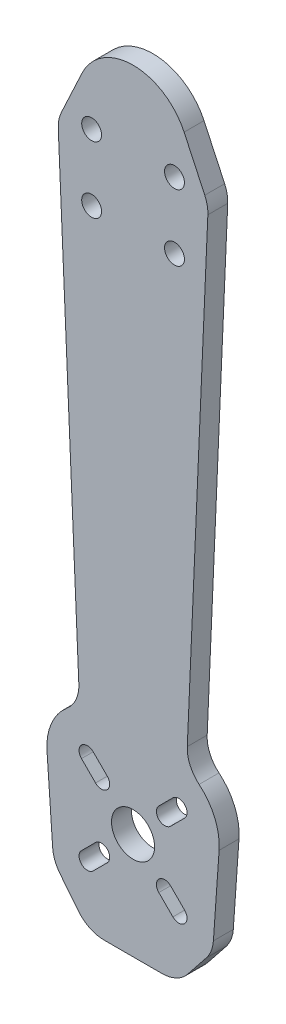
from build123d import *

# Parameters (mm, degrees)
CROQUIS1_R              = 3.25
CROQUIS1_R_2            = 1.5
SALIENTE_EXTRUIR1_DEPTH = 3


with BuildPart() as part:
    # Croquis1 → Saliente-Extruir1 (new body)
    with BuildSketch(Plane(origin=(0, 0, 0), x_dir=(-1, 0, 0), z_dir=(0, 0, -1))):
        with BuildLine():
            Line((8.181538342, 15.560412846), (11.282357346, 86.580844321))
            ThreePointArc((11.282357346, 86.580844321), (11.19104264, 87.774392868), (10.818655174, 88.912032567))
            Line((10.818655174, 88.912032567), (7.70361619, 95.592255225))
            ThreePointArc((7.70361619, 95.592255225), (0, 100.5), (-7.70361619, 95.592255225))
            Line((-7.70361619, 95.592255225), (-10.818655174, 88.912032567))
            ThreePointArc((-10.818655174, 88.912032567), (-11.19104264, 87.774392868), (-11.282357346, 86.580844321))
            Line((-11.282357346, 86.580844321), (-8.181538342, 15.560412846))
            ThreePointArc((-8.181538342, 15.560412846), (-8.600305132, 13.328393664), (-9.963157432, 11.511828536))
            ThreePointArc((-9.963157432, 11.511828536), (-12.324154236, 8.321537367), (-12.979294427, 4.407069973))
            Line((-12.979294427, 4.407069973), (-12.122281745, -7.848782369))
            ThreePointArc((-12.122281745, -7.848782369), (-11.79450084, -9.312190191), (-11.047502278, -10.612573183))
            Line((-11.047502278, -10.612573183), (-8.26347657, -14.112573183))
            ThreePointArc((-8.26347657, -14.112573183), (-6.522662073, -15.503491197), (-4.350435786, -16))
            Line((-4.350435786, -16), (4.350435786, -16))
            ThreePointArc((4.350435786, -16), (6.522662073, -15.503491197), (8.26347657, -14.112573183))
            Line((8.26347657, -14.112573183), (11.047502278, -10.612573183))
            ThreePointArc((11.047502278, -10.612573183), (11.79450084, -9.312190191), (12.122281745, -7.848782369))
            Line((12.122281745, -7.848782369), (12.979294427, 4.407069973))
            ThreePointArc((12.979294427, 4.407069973), (12.324154236, 8.321537367), (9.963157432, 11.511828536))
            ThreePointArc((9.963157432, 11.511828536), (8.600305132, 13.328393664), (8.181538342, 15.560412846))
        make_face()
        with Locations(Location((0, 0, 0), (0, 0, 180))):
            Circle(CROQUIS1_R, mode=Mode.SUBTRACT)
        with Locations(Location((6.25, 89, 0), (0, 0, 180))):
            Circle(CROQUIS1_R_2, mode=Mode.SUBTRACT)
        with Locations(Location((6.25, 79, 0), (0, 0, 180))):
            Circle(CROQUIS1_R_2, mode=Mode.SUBTRACT)
        with Locations(Location((-6.25, 89, 0), (0, 0, 180))):
            Circle(CROQUIS1_R_2, mode=Mode.SUBTRACT)
        with Locations(Location((-6.25, 79, 0), (0, 0, 180))):
            Circle(CROQUIS1_R_2, mode=Mode.SUBTRACT)
        with BuildLine():
            Line((7.778174593, 6.01040764), (5.656854249, 3.889087297))
            ThreePointArc((5.656854249, 3.889087297), (3.889087297, 3.889087297), (3.889087297, 5.656854249))
            Line((3.889087297, 5.656854249), (6.01040764, 7.778174593))
            ThreePointArc((6.01040764, 7.778174593), (7.778174593, 7.778174593), (7.778174593, 6.01040764))
        make_face(mode=Mode.SUBTRACT)
        with BuildLine():
            Line((-5.656854249, 3.889087297), (-7.778174593, 6.01040764))
            ThreePointArc((-7.778174593, 6.01040764), (-7.778174593, 7.778174593), (-6.01040764, 7.778174593))
            Line((-6.01040764, 7.778174593), (-3.889087297, 5.656854249))
            ThreePointArc((-3.889087297, 5.656854249), (-3.889087297, 3.889087297), (-5.656854249, 3.889087297))
        make_face(mode=Mode.SUBTRACT)
        with BuildLine():
            Line((-3.889087297, -5.656854249), (-6.01040764, -7.778174593))
            ThreePointArc((-6.01040764, -7.778174593), (-7.778174593, -7.778174593), (-7.778174593, -6.01040764))
            Line((-7.778174593, -6.01040764), (-5.656854249, -3.889087297))
            ThreePointArc((-5.656854249, -3.889087297), (-3.889087297, -3.889087297), (-3.889087297, -5.656854249))
        make_face(mode=Mode.SUBTRACT)
        with BuildLine():
            Line((6.01040764, -7.778174593), (3.889087297, -5.656854249))
            ThreePointArc((3.889087297, -5.656854249), (3.889087297, -3.889087297), (5.656854249, -3.889087297))
            Line((5.656854249, -3.889087297), (7.778174593, -6.01040764))
            ThreePointArc((7.778174593, -6.01040764), (7.778174593, -7.778174593), (6.01040764, -7.778174593))
        make_face(mode=Mode.SUBTRACT)
    extrude(amount=-SALIENTE_EXTRUIR1_DEPTH)


solid = part.part
